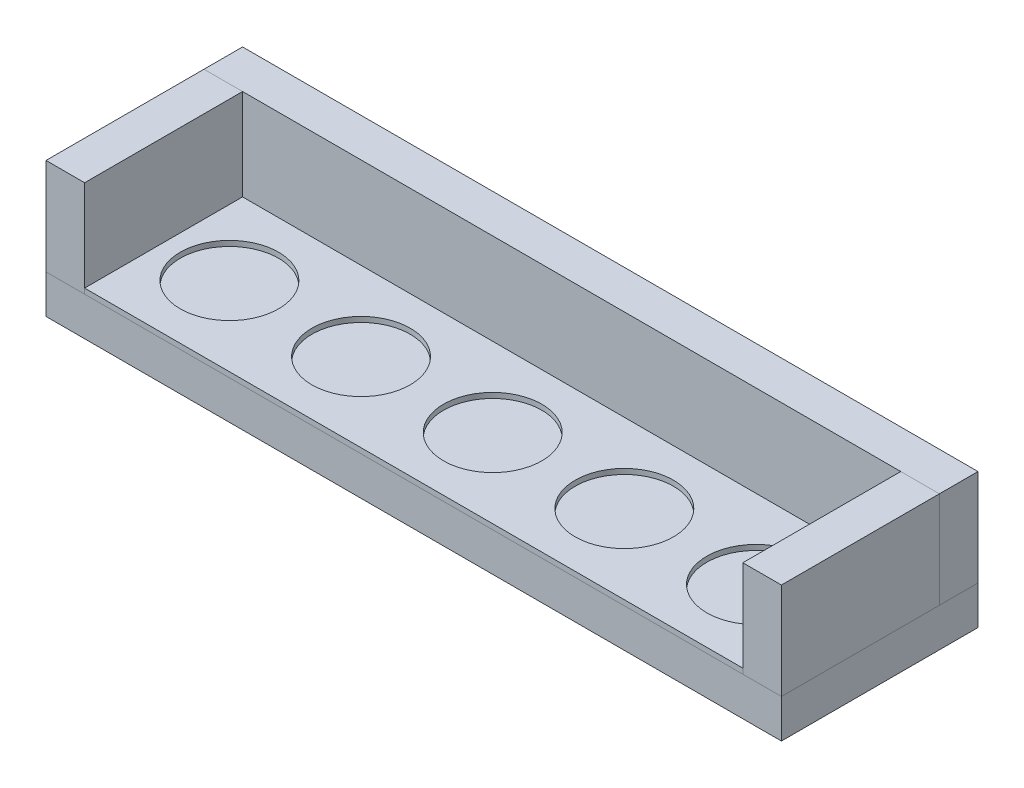
from build123d import *

# Parameters (mm, degrees)
ESQUISSE1_W          = 419
ESQUISSE1_H          = 112
BOSS_EXTRU_1_DEPTH   = 22
ESQUISSE2_W          = 419
ESQUISSE2_H          = 22
BOSS_EXTRU_2_DEPTH   = 55
ESQUISSE3_W          = 22
ESQUISSE3_H          = 90
BOSS_EXTRU_3_DEPTH   = 55
BOSS_EXTRU_3_2_DEPTH = 55
ESQUISSE4_W          = 375
ESQUISSE4_H          = 90
ESQUISSE4_R          = 28
BOSS_EXTRU_4_DEPTH   = 3


with BuildPart() as part:
    # Esquisse1 → Boss.-Extru.1 (new body)
    with BuildSketch(Plane(origin=(0, 0, 0), x_dir=(1, 0, 0), z_dir=(0, 1, 0))):
        with Locations((0, 56)):
            Rectangle(ESQUISSE1_W, ESQUISSE1_H)
    extrude(amount=BOSS_EXTRU_1_DEPTH)


with BuildPart() as body_2:
    # Esquisse2 → Boss.-Extru.2 (new body)
    with BuildSketch(Plane(origin=(0, 22, 0), x_dir=(1, 0, 0), z_dir=(0, 1, 0))):
        with Locations((0, 101)):
            Rectangle(ESQUISSE2_W, ESQUISSE2_H)
    extrude(amount=BOSS_EXTRU_2_DEPTH)


with BuildPart() as body_3:
    # Esquisse3 → Boss.-Extru.3 (new body)
    with BuildSketch(Plane(origin=(0, 22, 0), x_dir=(1, 0, 0), z_dir=(0, 1, 0))):
        with Locations((-198.5, 45)):
            Rectangle(ESQUISSE3_W, ESQUISSE3_H)
    extrude(amount=BOSS_EXTRU_3_DEPTH)


with BuildPart() as body_4:
    # Esquisse3 → Boss.-Extru.3 2 (new body)
    with BuildSketch(Plane(origin=(0, 22, 0), x_dir=(1, 0, 0), z_dir=(0, 1, 0))):
        with Locations((198.5, 45)):
            Rectangle(ESQUISSE3_W, ESQUISSE3_H)
    extrude(amount=BOSS_EXTRU_3_2_DEPTH)


with BuildPart() as body_5:
    # Esquisse4 → Boss.-Extru.4 (new body)
    with BuildSketch(Plane(origin=(0, 22, 0), x_dir=(1, 0, 0), z_dir=(0, 1, 0))):
        with Locations((0, 45)):
            Rectangle(ESQUISSE4_W, ESQUISSE4_H)
        with Locations(Location((-150, 45, 0), (0, 0, 270))):
            Circle(ESQUISSE4_R, mode=Mode.SUBTRACT)
        with Locations(Location((-75, 45, 0), (0, 0, 270))):
            Circle(ESQUISSE4_R, mode=Mode.SUBTRACT)
        with Locations(Location((0, 45, 0), (0, 0, 270))):
            Circle(ESQUISSE4_R, mode=Mode.SUBTRACT)
        with Locations(Location((75, 45, 0), (0, 0, 270))):
            Circle(ESQUISSE4_R, mode=Mode.SUBTRACT)
        with Locations(Location((150, 45, 0), (0, 0, 270))):
            Circle(ESQUISSE4_R, mode=Mode.SUBTRACT)
    extrude(amount=BOSS_EXTRU_4_DEPTH)


solid = Compound([part.part, body_2.part, body_3.part, body_4.part, body_5.part])
